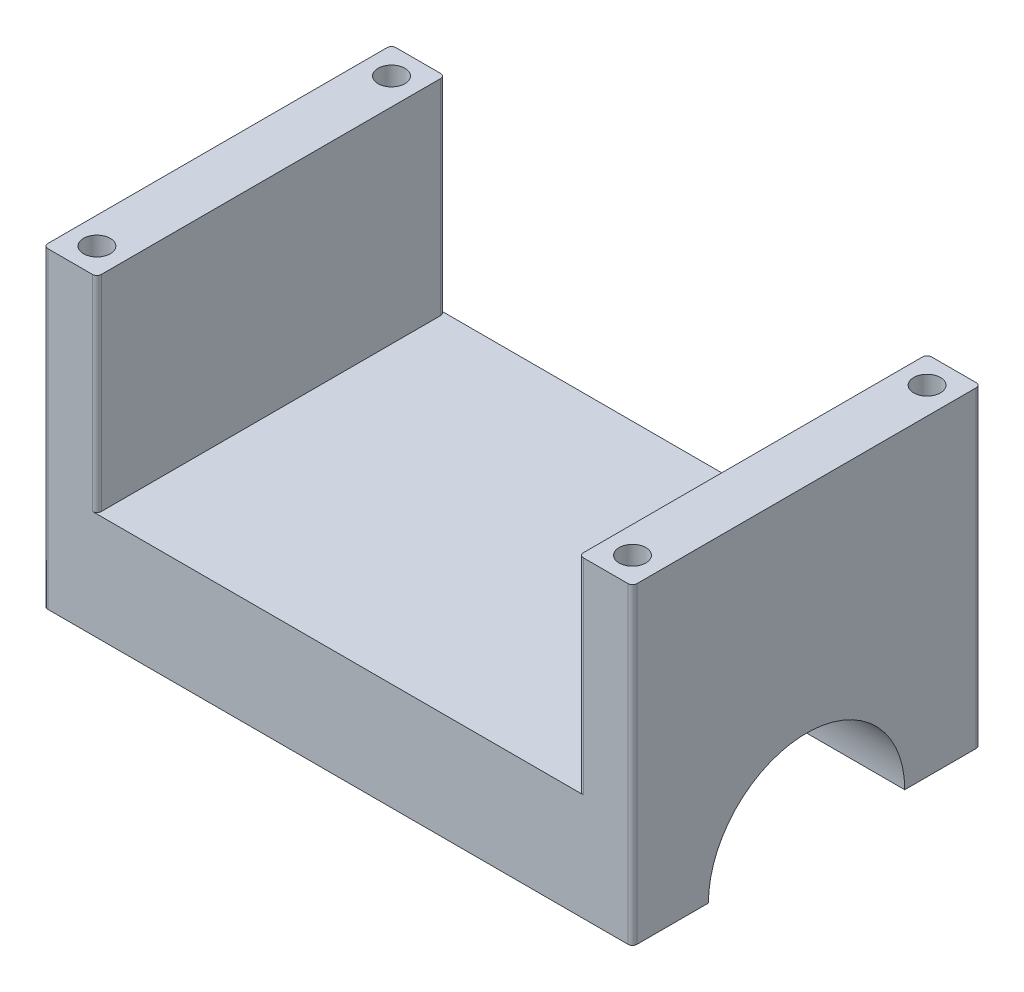
from build123d import *

# Parameters (mm, degrees)
SKETCH1_W           = 66
SKETCH1_H           = 39
BOSS_EXTRUDE1_DEPTH = 35
SKETCH3_W           = 54
SKETCH3_H           = 39
CUT_EXTRUDE1_DEPTH  = 23
SKETCH4_R           = 11
CUT_EXTRUDE2_DEPTH  = 85.273364713
SKETCH5_R           = 1.5
CUT_EXTRUDE3_DEPTH  = 85.273364713
FILLET2_R           = 0.5


with BuildPart() as part:
    # Sketch1 → Boss-Extrude1 (new body)
    with BuildSketch(Plane(origin=(0, 0, 0), x_dir=(1, 0, 0), z_dir=(0, 1, 0))):
        with Locations((33, 19.5)):
            Rectangle(SKETCH1_W, SKETCH1_H)
    extrude(amount=BOSS_EXTRUDE1_DEPTH)

    # Sketch3 → Cut-Extrude1 (cut)
    with BuildSketch(Plane(origin=(0, 35, 0), x_dir=(1, 0, 0), z_dir=(0, 1, 0))):
        with Locations((33, 19.5)):
            Rectangle(SKETCH3_W, SKETCH3_H)
    extrude(amount=-CUT_EXTRUDE1_DEPTH, mode=Mode.SUBTRACT)

    # Sketch4 → Cut-Extrude2 (cut, through all)
    with BuildSketch(Plane(origin=(66, 0, 0), x_dir=(0, 0, -1), z_dir=(1, 0, 0))):
        with Locations((19.5, 0)):
            Circle(SKETCH4_R)
    extrude(amount=-CUT_EXTRUDE2_DEPTH, mode=Mode.SUBTRACT)

    # Sketch5 → Cut-Extrude3 (cut, through all)
    with BuildSketch(Plane(origin=(0, 35, 0), x_dir=(1, 0, 0), z_dir=(0, 1, 0))):
        with Locations(Location((3, 3, 0), (0, 0, 270))):
            Circle(SKETCH5_R)
        with Locations(Location((63, 3, 0), (0, 0, 270))):
            Circle(SKETCH5_R)
        with Locations(Location((63, 36, 0), (0, 0, 270))):
            Circle(SKETCH5_R)
        with Locations(Location((3, 36, 0), (0, 0, 270))):
            Circle(SKETCH5_R)
    extrude(amount=-CUT_EXTRUDE3_DEPTH, mode=Mode.SUBTRACT)

    # Fillet2
    fillet2_edges = [part.edges().sort_by_distance(p)[0] for p in [
        (60, 23.5, 0),
        (60, 23.5, -39),
        (6, 23.5, -39),
        (6, 23.5, 0),
        (0, 17.5, -39),
        (66, 17.5, -39),
        (66, 17.5, 0),
        (0, 17.5, 0),
    ]]
    fillet(fillet2_edges, radius=FILLET2_R)


solid = part.part
